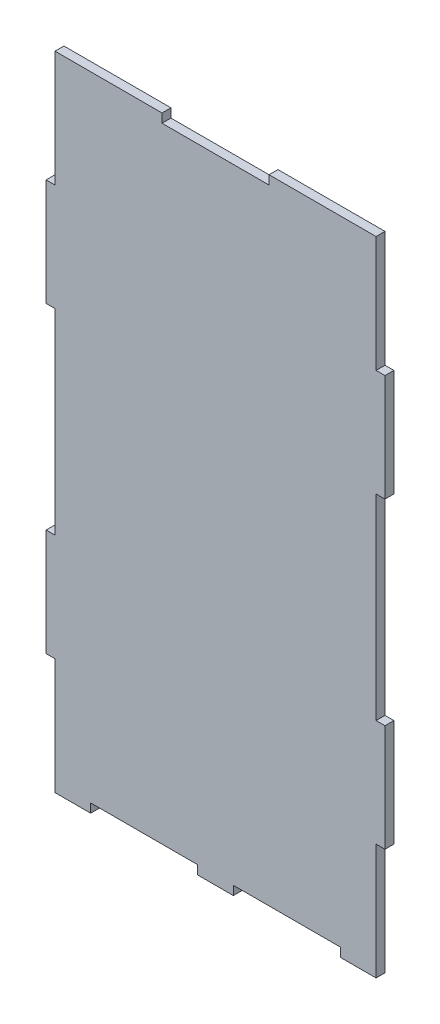
from build123d import *

# Parameters (mm, degrees)
SKETCH1_W           = 228.6
SKETCH1_H           = 457.2
BOSS_EXTRUDE1_DEPTH = 6.35
SKETCH2_W           = 6.35
SKETCH2_H           = 76.2
BOSS_EXTRUDE4_DEPTH = 6.35
SKETCH3_W           = 76.2
SKETCH3_H           = 6.35
CUT_EXTRUDE1_DEPTH  = 6.35


with BuildPart() as part:
    # Sketch1 → Boss-Extrude1 (new body)
    with BuildSketch(Plane.XY):
        with Locations((-78.307659574, -48.638297872)):
            Rectangle(SKETCH1_W, SKETCH1_H)
    extrude(amount=BOSS_EXTRUDE1_DEPTH)

    # Sketch2 → Boss-Extrude4 (add, through all)
    with BuildSketch(Plane.XY.offset(6.35)):
        with Locations((-195.782659574, 59.311702128)):
            Rectangle(SKETCH2_W, SKETCH2_H)
        with Locations((-195.782659574, -156.588297872)):
            Rectangle(SKETCH2_W, SKETCH2_H)
        with Locations((39.167340426, -156.588297872)):
            Rectangle(SKETCH2_W, SKETCH2_H)
        with Locations((39.167340426, 59.311702128)):
            Rectangle(SKETCH2_W, SKETCH2_H)
    extrude(amount=-BOSS_EXTRUDE4_DEPTH)

    # Sketch3 → Cut-Extrude1 (cut)
    with BuildSketch(Plane.XY.offset(6.35)):
        with Locations((-129.107659574, -274.063297872)):
            Rectangle(SKETCH3_W, SKETCH3_H)
        with Locations((-27.507659574, -274.063297872)):
            Rectangle(SKETCH3_W, SKETCH3_H)
        with Locations((-78.307659574, 176.786702128)):
            Rectangle(SKETCH3_W, SKETCH3_H)
    extrude(amount=-CUT_EXTRUDE1_DEPTH, mode=Mode.SUBTRACT)


solid = part.part
